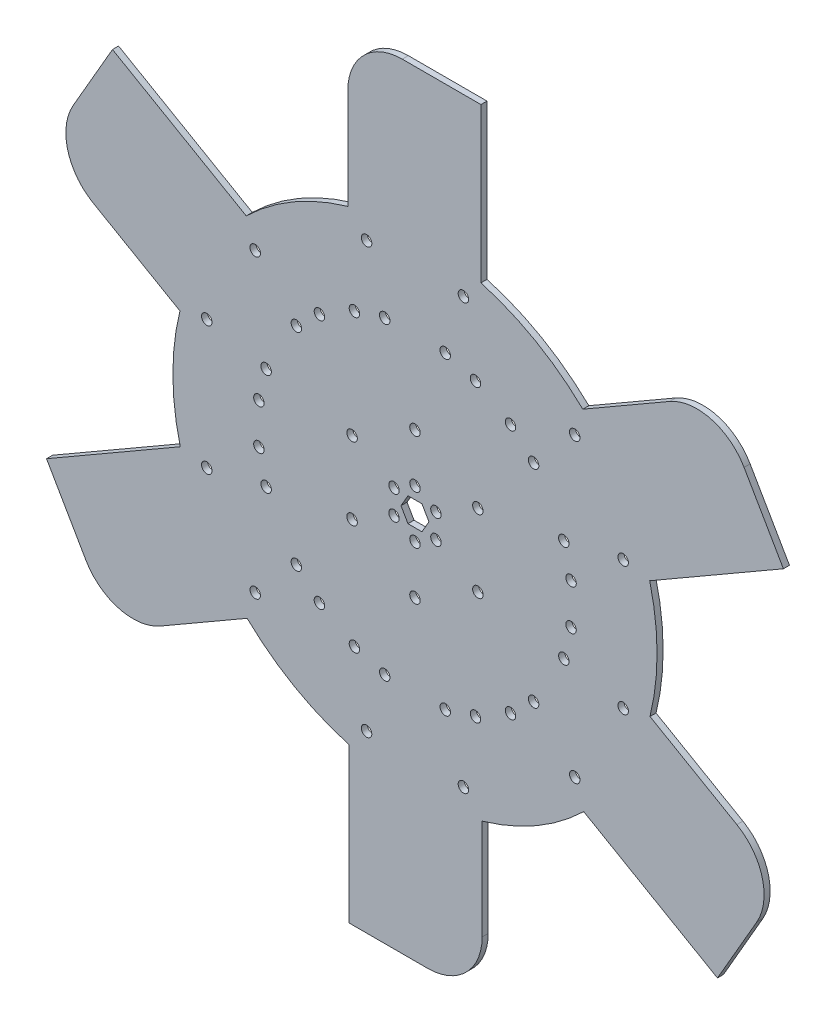
from build123d import *

# Parameters (mm, degrees)
SKETCH1_R            = 127
BOSS_EXTRUDE1_DEPTH  = 3.175
BOSS_EXTRUDE2_DEPTH  = 3.175
CIRPATTERN2_COUNT    = 6
CUT_EXTRUDE1_DEPTH   = 281.459484309
M5_CLEARANCE_HOLE1_D = 5.5
CIRPATTERN3_COUNT    = 6


with BuildPart() as part:
    # Sketch1 → Boss-Extrude1 (new body)
    with BuildSketch(Plane.XY):
        Circle(SKETCH1_R)
    extrude(amount=BOSS_EXTRUDE1_DEPTH)

    # Sketch6 → Boss-Extrude2 (add)
    with BuildSketch(Plane(origin=(0, 0, 0), x_dir=(-1, 0, 0), z_dir=(0, 0, -1))):
        with BuildLine():
            Line((-49.339907198, 69.180942427), (-133.608436136, 117.833400293))
            ThreePointArc((-133.608436136, 117.833400293), (-155.29169035, 120.688054866), (-172.642612049, 107.37422438))
            Line((-172.642612049, 107.37422438), (-193.280112049, 71.629025839))
            Line((-193.280112049, 71.629025839), (-84.264907198, 8.689067972))
            Line((-84.264907198, 8.689067972), (-49.339907198, 69.180942427))
        make_face()
    boss_extrude2 = extrude(amount=-BOSS_EXTRUDE2_DEPTH)

    # CirPattern2: Boss-Extrude2 ×6 about axis
    cirpattern2_axis = Axis((0, 0, 0), (0, 0, 1))
    for i in range(1, CIRPATTERN2_COUNT):
        add(boss_extrude2.rotate(cirpattern2_axis, i * 360 / CIRPATTERN2_COUNT))

    # Sketch7 → Cut-Extrude1 (cut, through all)
    with BuildSketch(Plane.XY.offset(3.175)):
        Polygon((7.332348419, 0), (3.666174209, 6.35), (-3.666174209, 6.35), (-7.332348419, 0), (-3.666174209, -6.35), (3.666174209, -6.35), align=None)
    extrude(amount=-CUT_EXTRUDE1_DEPTH, mode=Mode.SUBTRACT)

    # M5 Clearance Hole1 (through all)
    with Locations(Plane(origin=(0, 0, 0), x_dir=(-1, 0, 0), z_dir=(0, 0, -1))):
        with Locations((-62.218505846, 54.252742145), (-78.093505846, 26.756435575), (-81.866135768, 10.60369343), (-109.211644375, 33.723978604), (-83.811644375, 77.718069116), (-50.116135768, 65.59630657), (-32.995567884, 19.05), (-10.998522628, 6.35)):
            m5_clearance_hole1 = Hole(M5_CLEARANCE_HOLE1_D / 2)

    # CirPattern3: M5 Clearance Hole1 ×6 about axis
    cirpattern3_axis = Axis((0, 0, 0), (0, 0, 1))
    for i in range(1, CIRPATTERN3_COUNT):
        add(m5_clearance_hole1.rotate(cirpattern3_axis, i * 360 / CIRPATTERN3_COUNT), mode=Mode.SUBTRACT)


solid = part.part
